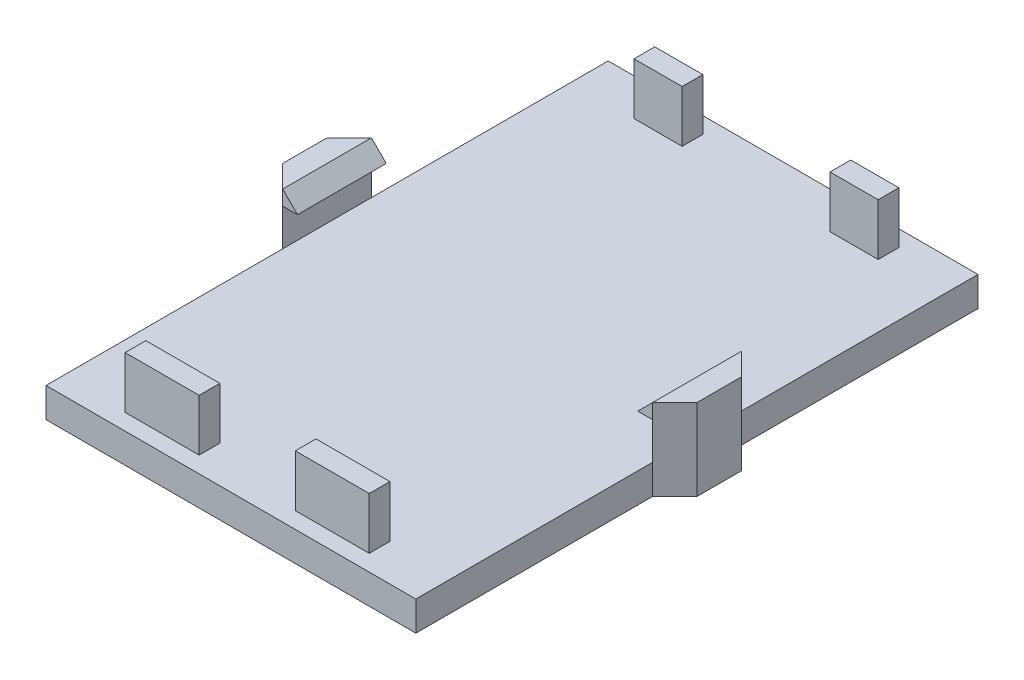
from build123d import *

# Parameters (mm, degrees)
SKETCH1_W                = 25
SKETCH1_H                = 38
SKETCH1_W_2              = 16.5
SKETCH1_H_2              = 1.4
BOSS_EXTRUDE1_DEPTH      = 2
SKETCH1_3_W              = 16.5
SKETCH1_3_H              = 1.4
BOSS_EXTRUDE2_DEPTH      = 5.5
BOSS_EXTRUDE3_DEPTH      = 3
BOSS_EXTRUDE3_DEPTH_BACK = 3
SKETCH3_W                = 6.5
SKETCH3_H                = 1.4
SKETCH3_W_2              = 10
CUT_EXTRUDE1_DEPTH       = 3.5


with BuildPart() as part:
    # Sketch1 → Boss-Extrude1 (new body)
    with BuildSketch(Plane(origin=(0, 0, 0), x_dir=(1, 0, 0), z_dir=(0, 1, 0))):
        Rectangle(SKETCH1_W, SKETCH1_H)
        with Locations((0, -17.2)):
            Rectangle(SKETCH1_W_2, SKETCH1_H_2, mode=Mode.SUBTRACT)
        with Locations((0, 17.2)):
            Rectangle(SKETCH1_W_2, SKETCH1_H_2, mode=Mode.SUBTRACT)
    extrude(amount=BOSS_EXTRUDE1_DEPTH)

    # Sketch1<3> → Boss-Extrude2 (add)
    with BuildSketch(Plane(origin=(0, 0, 0), x_dir=(1, 0, 0), z_dir=(0, 1, 0))):
        Polygon((-14, -1.5), (-12.5, -3), (-12.5, 3), (-14, 1.5), align=None)
        Polygon((12.5, 3), (12.5, -3), (14, -1.5), (14, 1.5), align=None)
        with Locations((0, 17.2)):
            Rectangle(SKETCH1_3_W, SKETCH1_3_H)
        with Locations((0, -17.2)):
            Rectangle(SKETCH1_3_W, SKETCH1_3_H)
    extrude(amount=BOSS_EXTRUDE2_DEPTH)

    # Sketch2 → Boss-Extrude3 (add, two sides: drawn at the far end of the back side and taken through both)
    with BuildSketch(Plane.XY.offset(-BOSS_EXTRUDE3_DEPTH_BACK)):
        Polygon((12.5, 5.5), (11.5, 4.5), (12.5, 4.5), align=None)
        Polygon((-11.5, 4.5), (-12.5, 4.5), (-12.5, 5.5), align=None)
    extrude(amount=BOSS_EXTRUDE3_DEPTH + BOSS_EXTRUDE3_DEPTH_BACK)

    # Sketch3 → Cut-Extrude1 (cut)
    with BuildSketch(Plane(origin=(0, 2, 0), x_dir=(1, 0, 0), z_dir=(0, 1, 0))):
        with Locations((0, -17.2)):
            Rectangle(SKETCH3_W, SKETCH3_H)
        with Locations((0, 17.2)):
            Rectangle(SKETCH3_W_2, SKETCH3_H)
    extrude(amount=CUT_EXTRUDE1_DEPTH, mode=Mode.SUBTRACT)


solid = part.part
